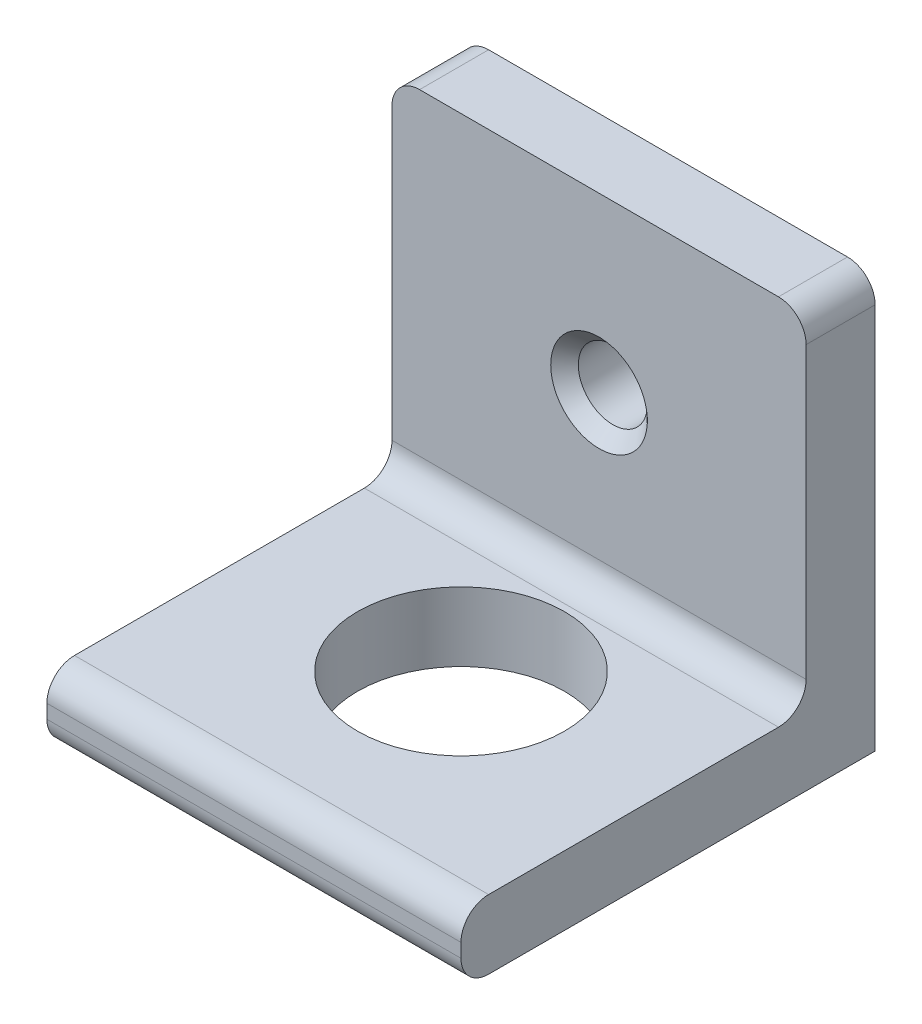
from build123d import *

# Parameters (mm, degrees)
SKETCH1_W           = 150
SKETCH1_H           = 30
BOSS_EXTRUDE1_DEPTH = 5
SKETCH3_W           = 150
SKETCH3_H           = 5
BOSS_EXTRUDE2_DEPTH = 25
SKETCH6_R           = 7.5
SKETCH6_R_2         = 5
CUT_EXTRUDE2_DEPTH  = 25
SKETCH7_R           = 2.5
CUT_EXTRUDE3_DEPTH  = 25
CHAMFER1_SIZE       = 1
FILLET2_R           = 2
SKETCH8_W           = 43.274843737
SKETCH8_H           = 64.613346869
CUT_EXTRUDE4_DEPTH  = 120
FILLET3_R           = 2


with BuildPart() as part:
    # Sketch1 → Boss-Extrude1 (new body)
    with BuildSketch(Plane(origin=(0, 0, 0), x_dir=(1, 0, 0), z_dir=(0, 1, 0))):
        with Locations((22.308802864, -0.815715524)):
            Rectangle(SKETCH1_W, SKETCH1_H)
    extrude(amount=BOSS_EXTRUDE1_DEPTH)

    # Sketch3 → Boss-Extrude2 (add)
    with BuildSketch(Plane(origin=(0, 5, 0), x_dir=(1, 0, 0), z_dir=(0, 1, 0))):
        with Locations((22.308802864, 11.684284476)):
            Rectangle(SKETCH3_W, SKETCH3_H)
    extrude(amount=BOSS_EXTRUDE2_DEPTH)

    # Sketch6 → Cut-Extrude2 (cut)
    with BuildSketch(Plane(origin=(0, 5, 0), x_dir=(1, 0, 0), z_dir=(0, 1, 0))):
        with Locations(Location((82.308802864, -0.815715524, 0), (0, 0, 90))):
            Circle(SKETCH6_R)
        with Locations(Location((54.808802864, -8.315715524, 0), (0, 0, 90))):
            Circle(SKETCH6_R_2)
        with Locations(Location((29.808802864, -8.315715524, 0), (0, 0, 90))):
            Circle(SKETCH6_R_2)
        with Locations(Location((2.308802864, -8.315715524, 0), (0, 0, 90))):
            Circle(SKETCH6_R_2)
        with Locations(Location((-37.691197136, -8.315715524, 0), (0, 0, 90))):
            Circle(SKETCH6_R_2)
    extrude(amount=-CUT_EXTRUDE2_DEPTH, mode=Mode.SUBTRACT)

    # Sketch7 → Cut-Extrude3 (cut)
    with BuildSketch(Plane.XY.offset(-9.184284476)):
        with Locations((82.308802864, 17.478664245)):
            Circle(SKETCH7_R)
        with Locations((-37.691197136, 17.478664245)):
            Circle(SKETCH7_R)
        with Locations((22.308802864, 17.478664245)):
            Circle(SKETCH7_R)
    extrude(amount=-CUT_EXTRUDE3_DEPTH, mode=Mode.SUBTRACT)

    # Chamfer1
    chamfer1_edges = [part.edges().sort_by_distance(p)[0] for p in [
        (79.808802864, 17.478664245, -9.184284476),
        (-40.191197136, 17.478664245, -9.184284476),
        (19.808802864, 17.478664245, -9.184284476),
    ]]
    chamfer(chamfer1_edges, length=CHAMFER1_SIZE)

    # Fillet2
    fillet2_edges = [part.edges().sort_by_distance(p)[0] for p in [
        (22.308802864, 5, 15.815715524),
        (22.308802864, 0, 15.815715524),
        (22.308802864, 5, -9.184284476),
        (-52.691197136, 30, -11.684284476),
        (97.308802864, 30, -11.684284476),
    ]]
    fillet(fillet2_edges, radius=FILLET2_R)

    # Sketch8 → Cut-Extrude4 (cut)
    with BuildSketch(Plane.ZY.offset(52.691197136)):
        with Locations((-0.153926337, 8.461505149)):
            Rectangle(SKETCH8_W, SKETCH8_H)
    extrude(amount=-CUT_EXTRUDE4_DEPTH, mode=Mode.SUBTRACT)

    # Fillet3
    fillet3_edges = [part.edges().sort_by_distance(p)[0] for p in [
        (67.308802864, 30, -11.684284476),
    ]]
    fillet(fillet3_edges, radius=FILLET3_R)


solid = part.part
